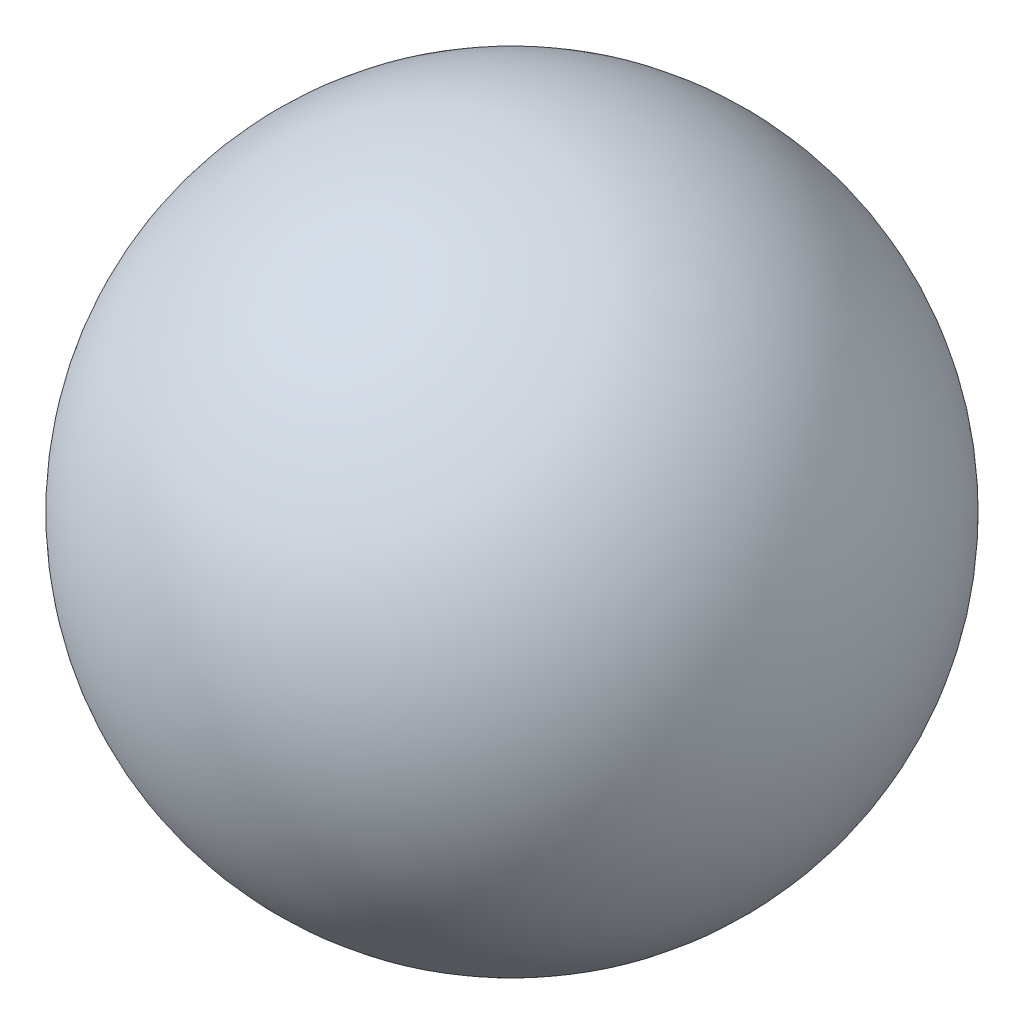
from build123d import *


with BuildPart() as part:
    # Sketch1 → Revolve1 (revolve)
    with BuildSketch(Plane(origin=(0, 0, 0), x_dir=(0, 0, -1), z_dir=(1, 0, 0))):
        with BuildLine():
            Line((0, 6.35), (0, -6.35))
            ThreePointArc((0, -6.35), (-6.35, 0), (0, 6.35))
        make_face()
    revolve(axis=Axis((0, 6.35, 0), (0, -1, 0)))


solid = part.part
